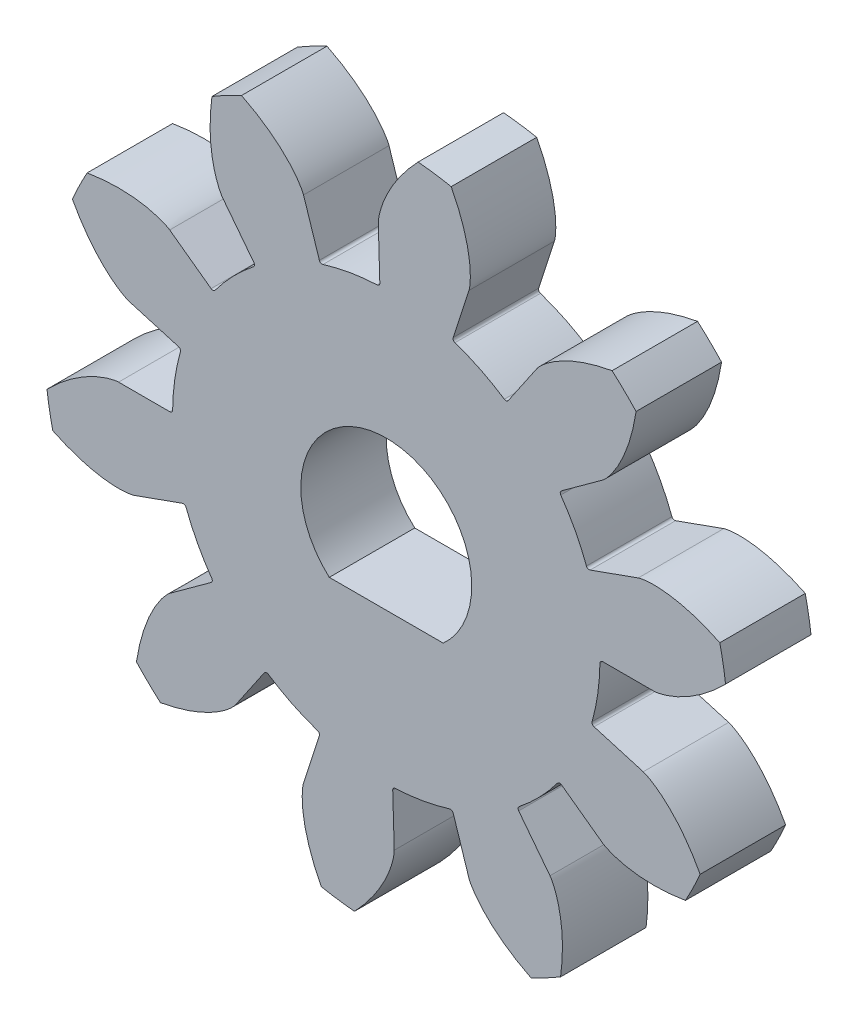
from build123d import *

# Parameters (mm, degrees)
SKETCH1_R                = 12
BOSS_EXTRUDE1_DEPTH      = 3
CUT_EXTRUDE1_DEPTH       = 18.23368794
FILLET2_R                = 0.1
FILLET4_R                = 0.1
CIRPATTERN2_COUNT        = 10
FILLET2_OF_CIRPATTERN2_R = 0.1
FILLET4_OF_CIRPATTERN2_R = 0.1


with BuildPart() as part:
    # Sketch1 → Boss-Extrude1 (new body)
    with BuildSketch(Plane.XY):
        Circle(SKETCH1_R)
        with BuildLine():
            Line((-2, -2.236067977), (2, -2.236067977))
            ThreePointArc((2, -2.236067977), (0, 3), (-2, -2.236067977))
        make_face(mode=Mode.SUBTRACT)
    extrude(amount=BOSS_EXTRUDE1_DEPTH)

    # Sketch3 → Cut-Extrude1 (cut, symmetric)
    with BuildSketch(Plane.XY):
        with BuildLine():
            Line((9.396926208, 0), (7.5, 0))
            ThreePointArc((7.5, 0), (7.424325846, -1.062725617), (7.19883047, -2.104005671))
            Line((7.19883047, -2.104005671), (9.019583828, -2.636158138))
            add(Edge.make_bspline(
                [(9.019583828, -2.636158138), (9.023830368, -2.637477685), (9.0356704, -2.641400855), (9.057769194, -2.649692836), (9.093380102, -2.664451024), (9.138062304, -2.68504655), (9.194959357, -2.713698067), (9.260829203, -2.750035841), (9.331936144, -2.792644004), (9.407842155, -2.841845355), (9.482227559, -2.893415968), (9.555131393, -2.947140786), (9.626550503, -3.002696291), (9.711586295, -3.072361103), (9.811466426, -3.159168042), (9.925037359, -3.265291677), (10.049994434, -3.391072615), (10.17305065, -3.524893813), (10.290547546, -3.661149636), (10.404970121, -3.80390432), (10.51262464, -3.945622208), (10.619854496, -4.097813017), (10.71651038, -4.240851286), (10.819548528, -4.406409481), (10.895818053, -4.532704986), (10.967175507, -4.660607792), (11.003430684, -4.727093031), (11.018033929, -4.75425371)],
                knots=[0, 0, 0, 0, 0, 0.005376749, 0.015083688, 0.02853182, 0.046610139, 0.064854849, 0.092110525, 0.119476176, 0.146842496, 0.174208854, 0.201574956, 0.228941013, 0.256307345, 0.307035032, 0.361767352, 0.41649966, 0.471231936, 0.525964282, 0.580696615, 0.635428982, 0.690161387, 0.744893688, 0.799626082, 0.854358408, 0.894707215, 0.894707215, 0.894707215, 0.894707215, 0.894707215], degree=4))
            ThreePointArc((11.018033929, -4.75425371), (11.751944672, -2.427302294), (12, 0))
            ThreePointArc((12, 0), (11.977309719, 0.737598733), (11.909324685, 1.472408079))
            add(Edge.make_bspline(
                [(9.396926208, 0), (9.401372402, 7.526e-05), (9.41383757, 0.000519359), (9.437375149, 0.002278903), (9.475696243, 0.006454388), (9.524361936, 0.013688001), (9.587011962, 0.025227427), (9.660430726, 0.041627285), (9.740635344, 0.062576557), (9.827295935, 0.088507958), (9.913161638, 0.117140063), (9.998209592, 0.1482555), (10.082346014, 0.181544627), (10.183510469, 0.224556544), (10.303732126, 0.279857887), (10.442513809, 0.34985951), (10.597738956, 0.435534878), (10.753395142, 0.529460896), (10.904398243, 0.627283354), (11.054273628, 0.732206157), (11.197361878, 0.838032468), (11.342980528, 0.954030283), (11.475882215, 1.064209445), (11.621227487, 1.194213783), (11.729864532, 1.294041572), (11.834237658, 1.396790122), (11.88768835, 1.450434771), (11.909324685, 1.472408079)],
                knots=[0, 0, 0, 0, 0, 0.005376749, 0.015083688, 0.02853182, 0.046610139, 0.064854849, 0.092110525, 0.119476176, 0.146842496, 0.174208854, 0.201574956, 0.228941013, 0.256307345, 0.307035032, 0.361767352, 0.41649966, 0.471231936, 0.525964282, 0.580696615, 0.635428982, 0.690161387, 0.744893688, 0.799626082, 0.854358408, 0.894707215, 0.894707215, 0.894707215, 0.894707215, 0.894707215], degree=4))
        make_face()
    cut_extrude1 = extrude(amount=CUT_EXTRUDE1_DEPTH, both=True, mode=Mode.SUBTRACT)

    # Fillet2
    fillet2_edges = [part.edges().sort_by_distance(p)[0] for p in [
        (7.5, 0, 1.5),
    ]]
    fillet(fillet2_edges, radius=FILLET2_R)

    # Fillet4
    fillet4_edges = [part.edges().sort_by_distance(p)[0] for p in [
        (7.19883047, -2.104005671, 1.5),
    ]]
    fillet(fillet4_edges, radius=FILLET4_R)

    # CirPattern2: Cut-Extrude1 ×10 about axis
    cirpattern2_axis = Axis((0, 0, 3), (0, 0, -1))
    for i in range(1, CIRPATTERN2_COUNT):
        add(cut_extrude1.rotate(cirpattern2_axis, i * 360 / CIRPATTERN2_COUNT), mode=Mode.SUBTRACT)

    # Fillet2 of CirPattern2
    fillet2_of_cirpattern2_edges = [part.edges().sort_by_distance(p)[0] for p in [
        (6.067627458, -4.408389392, 1.5),
        (2.317627458, -7.132923872, 1.5),
        (-2.317627458, -7.132923872, 1.5),
        (-6.067627458, -4.408389392, 1.5),
        (-7.5, 0, 1.5),
        (-6.067627458, 4.408389392, 1.5),
        (-2.317627458, 7.132923872, 1.5),
        (2.317627458, 7.132923872, 1.5),
        (6.067627458, 4.408389392, 1.5),
    ]]
    fillet(fillet2_of_cirpattern2_edges, radius=FILLET2_OF_CIRPATTERN2_R)

    # Fillet4 of CirPattern2
    fillet4_of_cirpattern2_edges = [part.edges().sort_by_distance(p)[0] for p in [
        (4.587272685, -5.933542728, 1.5),
        (0.223532651, -7.496668137, 1.5),
        (-4.225589259, -6.196321119, 1.5),
        (-7.060679694, -2.52919004, 1.5),
        (-7.19883047, 2.104005671, 1.5),
        (-4.587272685, 5.933542728, 1.5),
        (-0.223532651, 7.496668137, 1.5),
        (4.225589259, 6.196321119, 1.5),
        (7.060679694, 2.52919004, 1.5),
    ]]
    fillet(fillet4_of_cirpattern2_edges, radius=FILLET4_OF_CIRPATTERN2_R)


solid = part.part
